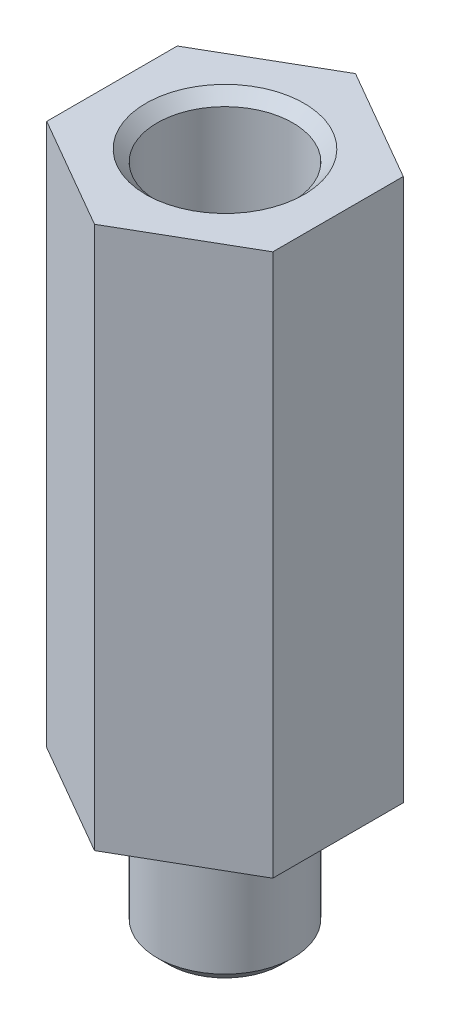
from build123d import *

# Parameters (mm, degrees)
BOSS_EXTRUDE1_DEPTH = 6
SKETCH2_R           = 1.5
CUT_EXTRUDE1_DEPTH  = 8
SKETCH3_R           = 1.5
BOSS_EXTRUDE2_DEPTH = 3
CHAMFER2_SIZE       = 0.25


with BuildPart() as part:
    # Sketch1 → Boss-Extrude1 (new, symmetric)
    with BuildSketch(Plane(origin=(0, 0, 0), x_dir=(1, 0, 0), z_dir=(0, 1, 0))):
        Polygon((0, 2.886751346), (-2.5, 1.443375673), (-2.5, -1.443375673), (0, -2.886751346), (2.5, -1.443375673), (2.5, 1.443375673), align=None)
    extrude(amount=BOSS_EXTRUDE1_DEPTH, both=True)

    # Sketch2 → Cut-Extrude1 (cut)
    with BuildSketch(Plane(origin=(0, 6, 0), x_dir=(1, 0, 0), z_dir=(0, 1, 0))):
        with Locations(Location((0, 0, 0), (0, 0, 270))):
            Circle(SKETCH2_R)
    extrude(amount=-CUT_EXTRUDE1_DEPTH, mode=Mode.SUBTRACT)

    # Sketch3 → Boss-Extrude2 (add)
    with BuildSketch(Plane.XZ.offset(6)):
        with Locations(Location((0, 0, 0), (0, 0, 90))):
            Circle(SKETCH3_R)
    extrude(amount=BOSS_EXTRUDE2_DEPTH)

    # Chamfer2
    chamfer2_edges = [part.edges().sort_by_distance(p)[0] for p in [
        (0, 6, -1.5),
        (0, -9, -1.5),
    ]]
    chamfer(chamfer2_edges, length=CHAMFER2_SIZE)


solid = part.part
